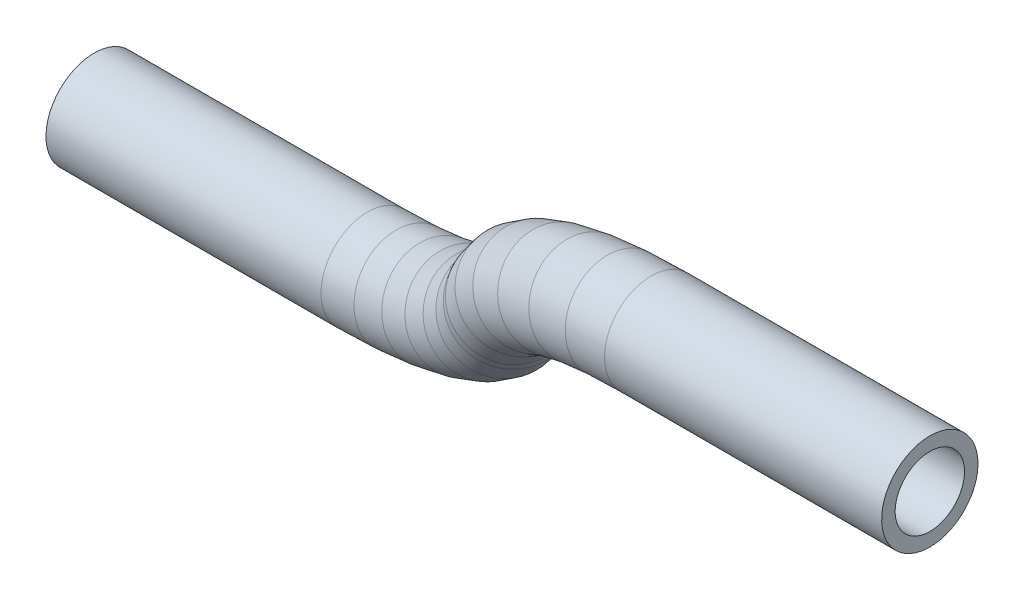
from build123d import *

# Parameters (mm, degrees)
PROFILE_R   = 3.175
PROFILE_R_2 = 2.286


with BuildPart() as part:
    # Tube: sweep along a curve in space
    with BuildLine() as tube_path:
        Line((-31.3, -15.256177825, -16.943702021), (-49.5, -15.256177825, -16.943702021))
        Line((-49.5, -15.256177825, -16.943702021), (-51.982179924, -15.43709513, -17.043876552))
        Line((-51.982179924, -15.43709513, -17.043876552), (-54.395918059, -15.974858567, -17.341638009))
        Line((-54.395918059, -15.974858567, -17.341638009), (-56.674659779, -16.854640244, -17.828776136))
        Line((-56.674659779, -16.854640244, -17.828776136), (-58.75557275, -18.052181714, -18.491858949))
        Line((-58.75557275, -18.052181714, -18.491858949), (-60.58127942, -19.534462857, -19.312603094))
        Line((-60.58127942, -19.534462857, -19.312603094), (-62.101439107, -21.260612351, -20.26837798))
        Line((-62.101439107, -21.260612351, -20.26837798), (-62.643876948, -21.995565474, -20.675324041))
        Line((-62.643876948, -21.995565474, -20.675324041), (-64.164036635, -23.721714968, -21.631098927))
        Line((-64.164036635, -23.721714968, -21.631098927), (-65.989743305, -25.203996111, -22.451843072))
        Line((-65.989743305, -25.203996111, -22.451843072), (-68.070656276, -26.401537581, -23.114925885))
        Line((-68.070656276, -26.401537581, -23.114925885), (-70.349397996, -27.281319258, -23.602064012))
        Line((-70.349397996, -27.281319258, -23.602064012), (-72.763136131, -27.819082695, -23.899825468))
        Line((-72.763136131, -27.819082695, -23.899825468), (-75.245316055, -28, -24))
        Line((-75.245316055, -28, -24), (-93.445316055, -28, -24))
    # Profile → Tube (sweep)
    with BuildSketch(Plane(origin=(-31.3, 0, 0), x_dir=(0, 0, -1), z_dir=(1, 0, 0))):
        with Locations((16.943702021, -15.256177825)):
            Circle(PROFILE_R)
        with Locations((16.943702021, -15.256177825)):
            Circle(PROFILE_R_2, mode=Mode.SUBTRACT)
    sweep(path=tube_path.line, transition=Transition.RIGHT)


solid = part.part
